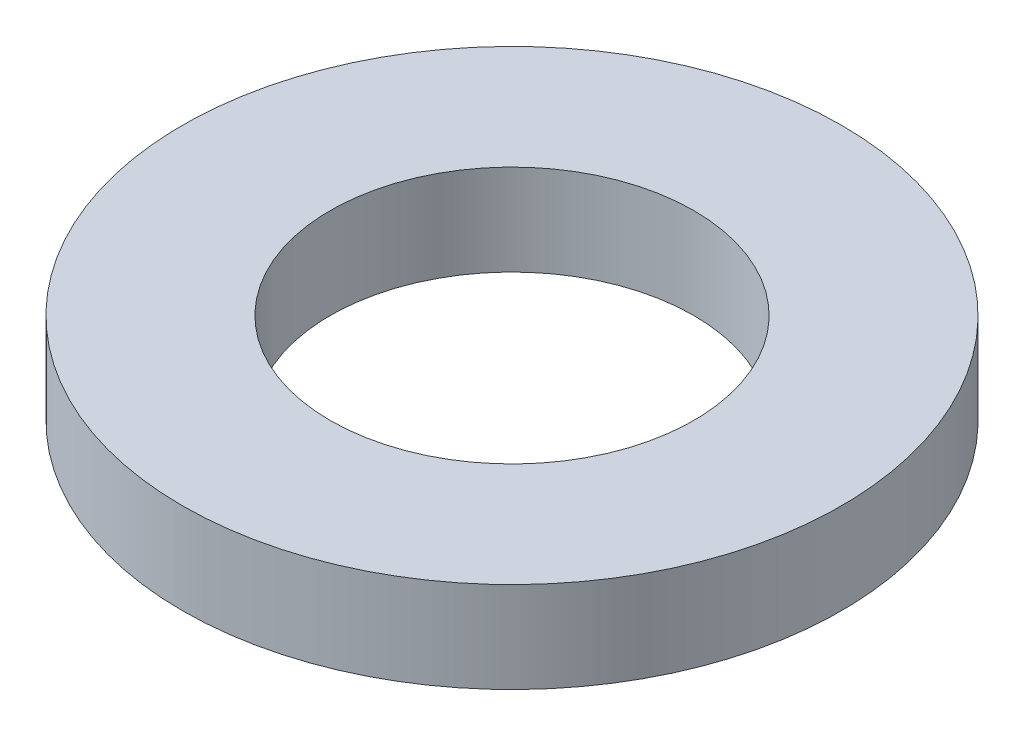
from build123d import *

# Parameters (mm, degrees)
SKETCH_1_R      = 2.9
SKETCH_1_R_2    = 1.6
EXTRUDE_1_DEPTH = 0.8


with BuildPart() as part:
    # 草图1 → 凸台-拉伸1 (new body)
    with BuildSketch(Plane(origin=(0, 0, 0), x_dir=(1, 0, 0), z_dir=(0, 1, 0))):
        with Locations(Location((0, 0, 0), (0, 0, 270))):
            Circle(SKETCH_1_R)
        with Locations(Location((0, 0, 0), (0, 0, 270))):
            Circle(SKETCH_1_R_2, mode=Mode.SUBTRACT)
    extrude(amount=EXTRUDE_1_DEPTH)


solid = part.part
